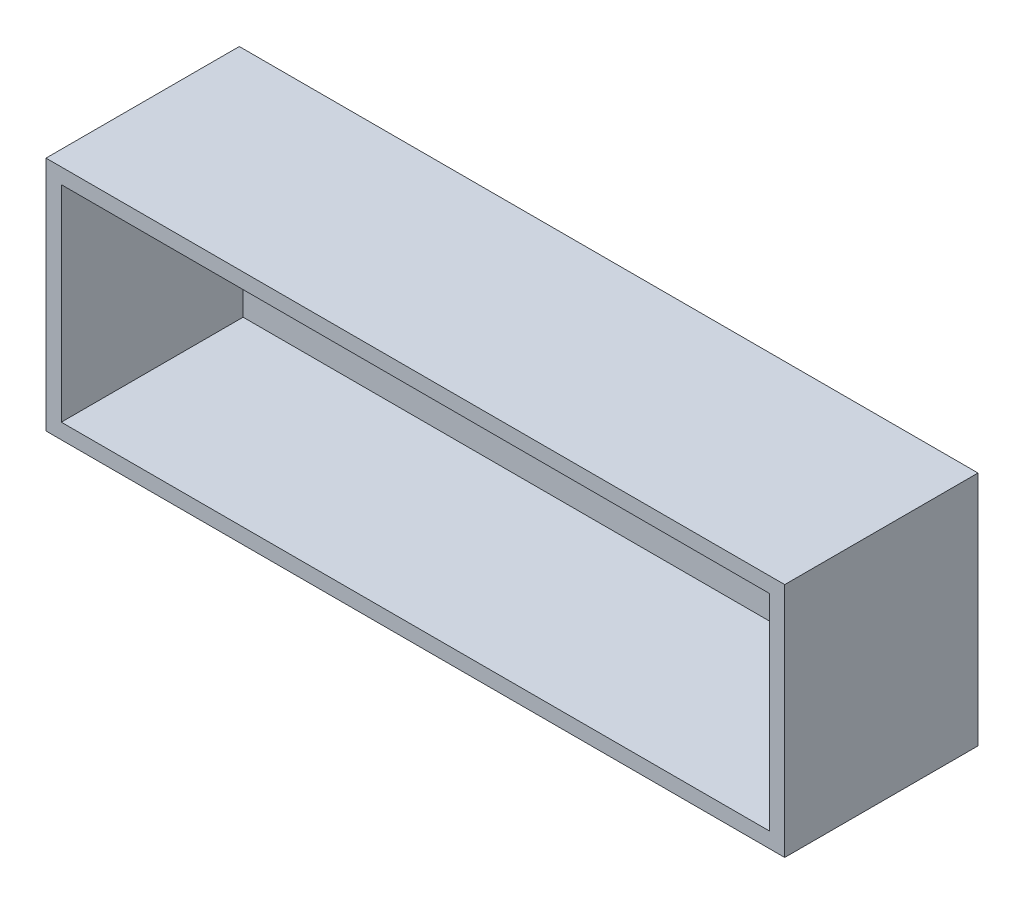
from build123d import *

# Parameters (mm, degrees)
SKETCH1_W           = 77.2
SKETCH1_H           = 24.7
SKETCH1_W_2         = 74
SKETCH1_H_2         = 21.5
BOSS_EXTRUDE1_DEPTH = 19
SKETCH1_2_W         = 77.2
SKETCH1_2_H         = 24.7
BOSS_EXTRUDE2_DEPTH = 1.2


with BuildPart() as part:
    # Sketch1 → Boss-Extrude1 (new body)
    with BuildSketch(Plane.XY):
        Rectangle(SKETCH1_W, SKETCH1_H)
        Rectangle(SKETCH1_W_2, SKETCH1_H_2, mode=Mode.SUBTRACT)
    extrude(amount=BOSS_EXTRUDE1_DEPTH)

    # Sketch1<2> → Boss-Extrude2 (add)
    with BuildSketch(Plane.XY):
        Rectangle(SKETCH1_2_W, SKETCH1_2_H)
    extrude(amount=-BOSS_EXTRUDE2_DEPTH)


solid = part.part
